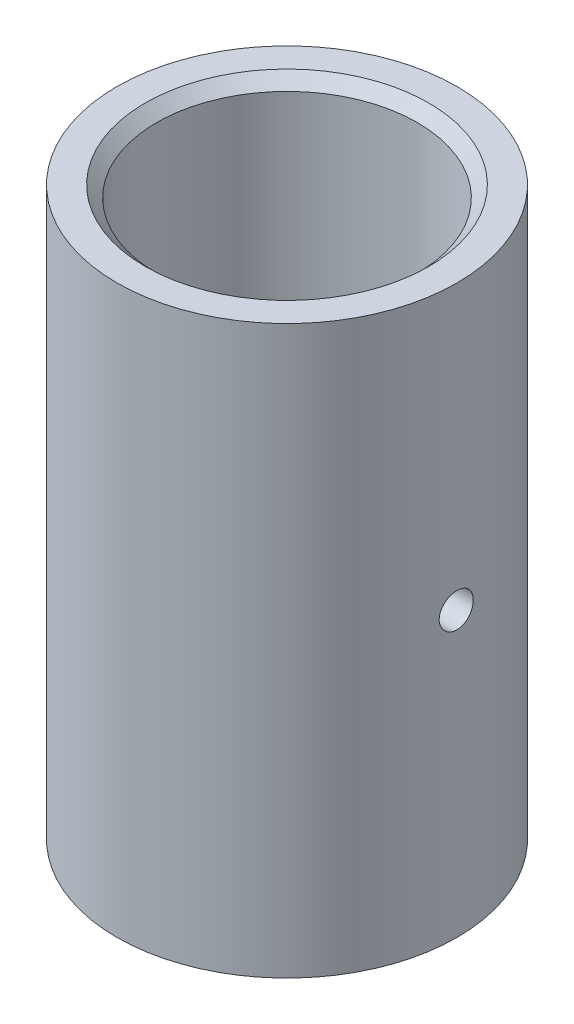
from build123d import *

# Parameters (mm, degrees)
SKETCH1_R                      = 7.5
BOSS_EXTRUDE1_DEPTH            = 25
SKETCH2_R                      = 5.75
CUT_EXTRUDE1_DEPTH             = 11
CHAMFER1_SIZE                  = 0.5
SKETCH3_R                      = 3.5
CUT_EXTRUDE2_DEPTH             = 10
CUT_EXTRUDE3_REACH             = 29.157
SKETCH4_R                      = 0.75
CUT_EXTRUDE3_DIRECTION_2_REACH = 29.157


with BuildPart() as part:
    # Sketch1 → Boss-Extrude1 (new body)
    with BuildSketch(Plane(origin=(0, 0, 0), x_dir=(1, 0, 0), z_dir=(0, 1, 0))):
        with Locations(Location((0, 0, 0), (0, 0, 270))):
            Circle(SKETCH1_R)
    extrude(amount=BOSS_EXTRUDE1_DEPTH)

    # Sketch2 → Cut-Extrude1 (cut)
    with BuildSketch(Plane(origin=(0, 25, 0), x_dir=(1, 0, 0), z_dir=(0, 1, 0))):
        with Locations(Location((0, 0, 0), (0, 0, 270))):
            Circle(SKETCH2_R)
    extrude(amount=-CUT_EXTRUDE1_DEPTH, mode=Mode.SUBTRACT)

    # Chamfer1
    chamfer1_edges = [part.edges().sort_by_distance(p)[0] for p in [
        (0, 25, -5.75),
    ]]
    chamfer(chamfer1_edges, length=CHAMFER1_SIZE)

    # Sketch3 → Cut-Extrude2 (cut)
    with BuildSketch(Plane(origin=(0, 14, 0), x_dir=(1, 0, 0), z_dir=(0, 1, 0))):
        with Locations(Location((0, 0, 0), (0, 0, 270))):
            Circle(SKETCH3_R)
    extrude(amount=-CUT_EXTRUDE2_DEPTH, mode=Mode.SUBTRACT)

    # Sketch4 → Cut-Extrude3 (cut, up to next)
    with BuildSketch(Plane(origin=(0, 0, 0), x_dir=(0, 0, -1), z_dir=(1, 0, 0)), mode=Mode.PRIVATE) as cut_extrude3_sk1:
        with Locations(Location((0, 12.5, 0), (0, 0, 180))):
            Circle(SKETCH4_R)
    cut_extrude3_tool1 = extrude(cut_extrude3_sk1.sketch, amount=-CUT_EXTRUDE3_REACH, mode=Mode.PRIVATE) & part.part
    add(cut_extrude3_tool1.solids().sort_by_distance((0, 12.5, 0))[0], mode=Mode.SUBTRACT)

    # Sketch4 → Cut-Extrude3 direction 2 (cut, up to next)
    with BuildSketch(Plane(origin=(0, 0, 0), x_dir=(0, 0, -1), z_dir=(1, 0, 0)), mode=Mode.PRIVATE) as cut_extrude3_direction_2_sk1:
        with Locations(Location((0, 12.5, 0), (0, 0, 180))):
            Circle(SKETCH4_R)
    cut_extrude3_direction_2_tool1 = extrude(cut_extrude3_direction_2_sk1.sketch, amount=CUT_EXTRUDE3_DIRECTION_2_REACH, mode=Mode.PRIVATE) & part.part
    add(cut_extrude3_direction_2_tool1.solids().sort_by_distance((0, 12.5, 0))[0], mode=Mode.SUBTRACT)


solid = part.part
